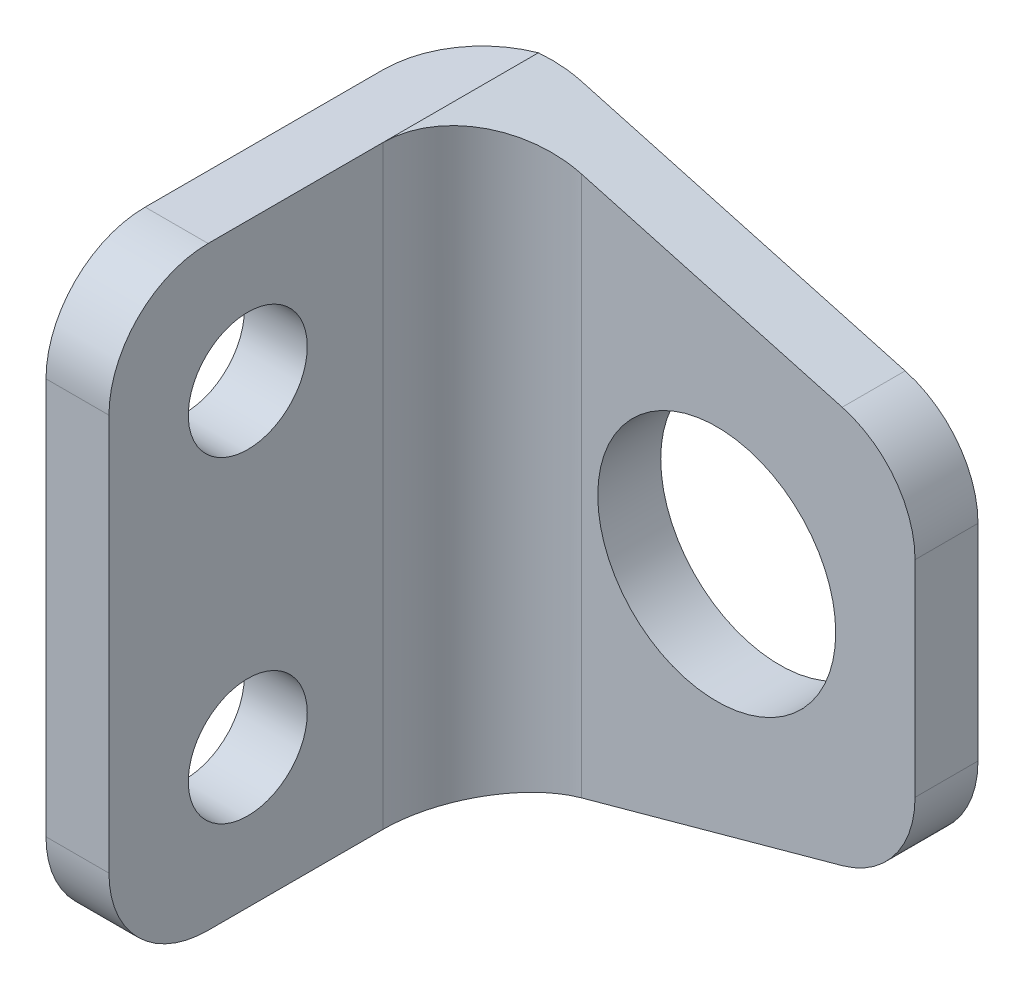
from build123d import *

# Parameters (mm, degrees)
SKETCH1_W           = 22
SKETCH1_H           = 30
BOSS_EXTRUDE1_DEPTH = 3.175
SKETCH2_W           = 25
SKETCH2_H           = 30
BOSS_EXTRUDE2_DEPTH = 3.175
SKETCH3_R           = 6
CUT_EXTRUDE1_DEPTH  = 45.821869662
CUT_EXTRUDE4_REACH  = 46.822
FILLET1_R           = 5
SKETCH4_R           = 3
CUT_EXTRUDE2_DEPTH  = 44.131550227


with BuildPart() as part:
    # Sketch1 → Boss-Extrude1 (new body)
    with BuildSketch(Plane(origin=(0, 0, 0), x_dir=(0, 0, -1), z_dir=(1, 0, 0))):
        with Locations((11, 15)):
            Rectangle(SKETCH1_W, SKETCH1_H)
    extrude(amount=BOSS_EXTRUDE1_DEPTH)

    # Sketch2 → Boss-Extrude2 (add)
    with BuildSketch(Plane(origin=(0, 0, -22), x_dir=(-1, 0, 0), z_dir=(0, 0, -1))):
        with Locations((-12.5, 15)):
            Rectangle(SKETCH2_W, SKETCH2_H)
    extrude(amount=-BOSS_EXTRUDE2_DEPTH)

    # Sketch3 → Cut-Extrude1 (cut, through all)
    with BuildSketch(Plane(origin=(0, 0, -22), x_dir=(-1, 0, 0), z_dir=(0, 0, -1))):
        with Locations((-15, 15)):
            Circle(SKETCH3_R)
    extrude(amount=-CUT_EXTRUDE1_DEPTH, mode=Mode.SUBTRACT)

    # Sketch5 → Cut-Extrude4 (cut, up to next)
    with BuildSketch(Plane(origin=(0, 0, -22), x_dir=(-1, 0, 0), z_dir=(0, 0, -1)), mode=Mode.PRIVATE) as cut_extrude4_sk1:
        Polygon((-3.175, 30), (-25, 24), (-25, 30), align=None)
    cut_extrude4_tool1 = extrude(cut_extrude4_sk1.sketch, amount=-CUT_EXTRUDE4_REACH, mode=Mode.PRIVATE) & part.part
    # Sketch5 → Cut-Extrude4 (cut, up to next)
    with BuildSketch(Plane(origin=(0, 0, -22), x_dir=(-1, 0, 0), z_dir=(0, 0, -1)), mode=Mode.PRIVATE) as cut_extrude4_sk2:
        Polygon((-25, 0), (-3.175, 0), (-25, 6), align=None)
    cut_extrude4_tool2 = extrude(cut_extrude4_sk2.sketch, amount=-CUT_EXTRUDE4_REACH, mode=Mode.PRIVATE) & part.part
    add(cut_extrude4_tool1.solids().sort_by_distance((17.725, 28, -22))[0], mode=Mode.SUBTRACT)
    add(cut_extrude4_tool2.solids().sort_by_distance((17.725, 2, -22))[0], mode=Mode.SUBTRACT)

    # Fillet1
    fillet1_edges = [part.edges().sort_by_distance(p)[0] for p in [
        (1.5875, 30, 0),
        (1.5875, 0, 0),
        (0, 15, -22),
        (3.175, 15, -18.825),
        (25, 6, -20.4125),
        (25, 24, -20.4125),
    ]]
    fillet(fillet1_edges, radius=FILLET1_R)

    # Sketch4 → Cut-Extrude2 (cut, through all)
    with BuildSketch(Plane(origin=(3.175, 0, 0), x_dir=(0, 0, -1), z_dir=(1, 0, 0))):
        with Locations((7, 23)):
            Circle(SKETCH4_R)
        with Locations((7, 7)):
            Circle(SKETCH4_R)
    extrude(amount=-CUT_EXTRUDE2_DEPTH, mode=Mode.SUBTRACT)


solid = part.part
